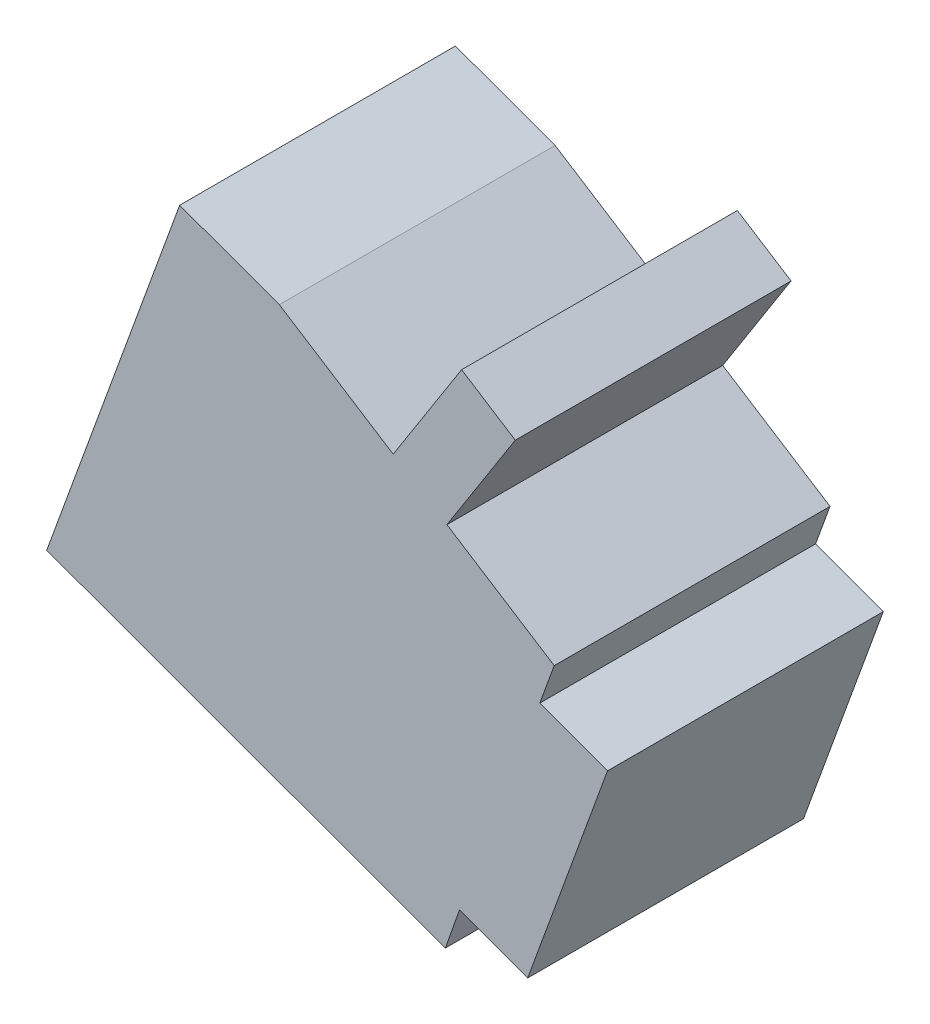
from build123d import *

# Parameters (mm, degrees)
SKETCH1_W      = 203.2
SKETCH1_H      = 101.6
EXTRUDE1_DEPTH = 50.8
EXTRUDE2_DEPTH = 16.51
SKETCH23_W     = 203.2
SKETCH23_H     = 50.8
EXTRUDE3_DEPTH = 508


with BuildPart() as part:
    # Sketch1 → Extrude1 (new body)
    with BuildSketch(Plane.XY):
        with Locations((101.6, 50.8)):
            Rectangle(SKETCH1_W, SKETCH1_H)
    extrude(amount=EXTRUDE1_DEPTH)

    # Sketch21 → Extrude2 (add)
    with BuildSketch(Plane.XY.offset(50.8)):
        Polygon((10.680914086, 39.466921448), (16.647962228, 37.295093538), (23.464694461, 32.952356157), (27.558917476, 39.378998974), (30.772238885, 37.331887466), (26.678015869, 30.905244649), (33.104658686, 26.811021633), (32.238976379, 24.432579042), (36.293520259, 22.947359397), (31.515498857, 9.819853485), (27.43078785, 11.306566707), (26.589174956, 8.909877207), (2.720982388, 17.597188848), align=None)
    extrude(amount=EXTRUDE2_DEPTH)

    # Sketch23 → Extrude3 (cut)
    with BuildSketch(Plane.XZ):
        with Locations((101.6, 25.4)):
            Rectangle(SKETCH23_W, SKETCH23_H)
    extrude(amount=-EXTRUDE3_DEPTH, mode=Mode.SUBTRACT)


solid = part.part
